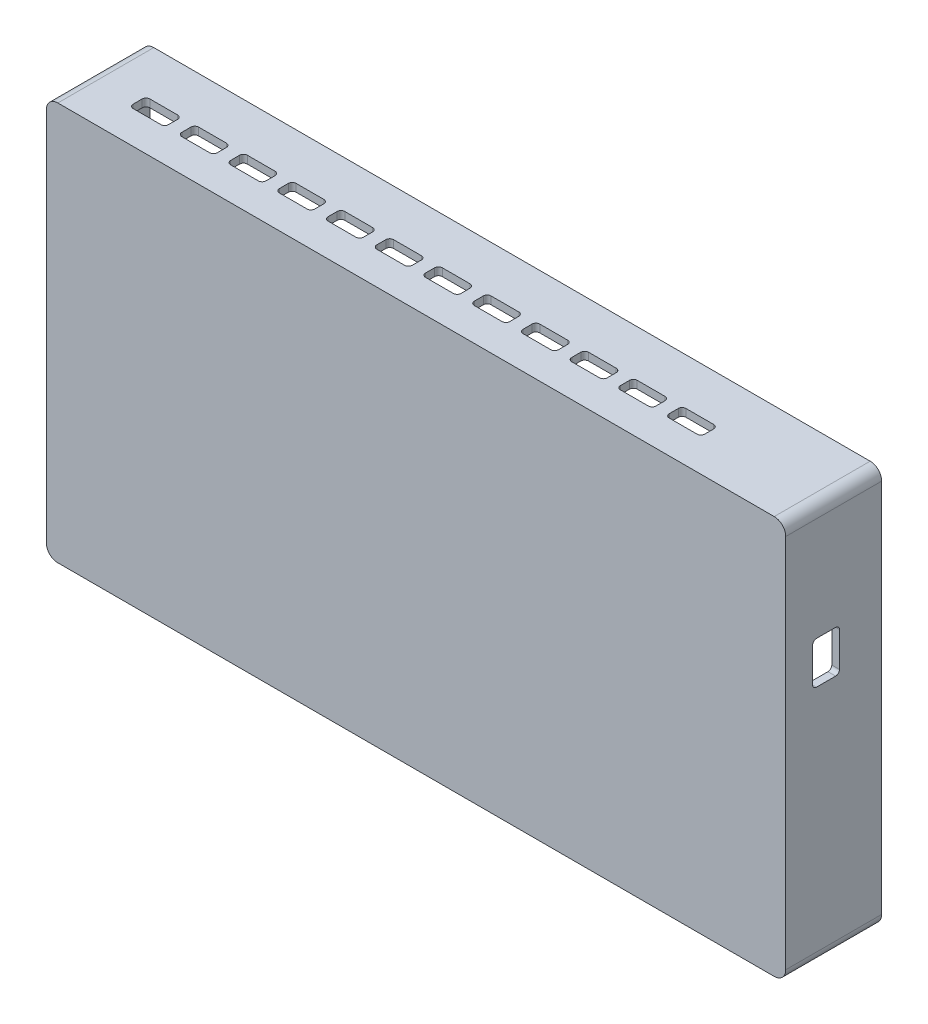
from build123d import *

# Parameters (mm, degrees)
BOSS_EXTRUDE1_START           = 5
BOSS_EXTRUDE1_DEPTH           = 2
SKETCH11_R                    = 3
BOSS_EXTRUDE2_DEPTH           = 3.5
SKETCH12_R                    = 1.05
BOSS_EXTRUDE3_DEPTH           = 1.5
BOSS_EXTRUDE3_DRAFT           = 10
BOSS_EXTRUDE3_PROFILE_2_DEPTH = 1.5
BOSS_EXTRUDE3_PROFILE_2_DRAFT = 10
BOSS_EXTRUDE3_PROFILE_3_DEPTH = 1.5
BOSS_EXTRUDE3_PROFILE_3_DRAFT = 10
BOSS_EXTRUDE3_PROFILE_4_DEPTH = 1.5
BOSS_EXTRUDE3_PROFILE_4_DRAFT = 10
FILLET2_R                     = 2
SKETCH13_R                    = 1.6
CUT_EXTRUDE1_DEPTH            = 3
BOSS_EXTRUDE4_START           = 23
BOSS_EXTRUDE4_DEPTH           = 23
FILLET3_R                     = 1
CUT_EXTRUDE2_DEPTH            = 2
LPATTERN1_COUNT               = 12
LPATTERN1_PITCH               = 12.7
SKETCH17_W                    = 7
SKETCH17_H                    = 11
CUT_EXTRUDE3_DEPTH            = 2
FILLET4_R                     = 1


with BuildPart() as part:
    # Sketch2 → Boss-Extrude1 (new body)
    with BuildSketch(Plane.XY.offset(BOSS_EXTRUDE1_START)):
        with BuildLine():
            Line((-186.174, -3.5), (0.5, -3.5))
            ThreePointArc((0.5, -3.5), (2.621320344, -2.621320344), (3.5, -0.5))
            Line((3.5, -0.5), (3.5, 97.274))
            ThreePointArc((3.5, 97.274), (2.621320344, 99.395320344), (0.5, 100.274))
            Line((0.5, 100.274), (-186.174, 100.274))
            ThreePointArc((-186.174, 100.274), (-188.295320344, 99.395320344), (-189.174, 97.274))
            Line((-189.174, 97.274), (-189.174, -0.5))
            ThreePointArc((-189.174, -0.5), (-188.295320344, -2.621320344), (-186.174, -3.5))
        make_face()
    extrude(amount=BOSS_EXTRUDE1_DEPTH)

    # Sketch11 → Boss-Extrude2 (add)
    with BuildSketch(Plane(origin=(0, 0, 5), x_dir=(-1, 0, 0), z_dir=(0, 0, -1))):
        with Locations((7.366, 91.059)):
            Circle(SKETCH11_R)
        with Locations((7.366, 4.699)):
            Circle(SKETCH11_R)
        with Locations((104.648, 42.799)):
            Circle(SKETCH11_R)
        with Locations((179.324, 5.207)):
            Circle(SKETCH11_R)
        with Locations((179.578, 75.565)):
            Circle(SKETCH11_R)
    extrude(amount=BOSS_EXTRUDE2_DEPTH)


with BuildPart() as boss_extrude3_tool:
    # Sketch12 → Boss-Extrude3 (with draft: the straight prism first)
    with BuildSketch(Plane(origin=(0, 0, 1.5), x_dir=(-1, 0, 0), z_dir=(0, 0, -1))):
        with Locations((7.366, 91.059)):
            Circle(SKETCH12_R)
    extrude(amount=BOSS_EXTRUDE3_DEPTH)
    # Boss-Extrude3: the draft: its side faces are tilted about the plane it starts from
    boss_extrude3_sides = [boss_extrude3_tool.faces().sort_by_distance(p)[0] for p in [
        (-6.316, 91.059, 0.75),
    ]]
    draft(boss_extrude3_sides, Plane(origin=(0, 0, 1.5), x_dir=(-1, 0, 0), z_dir=(0, 0, -1)), BOSS_EXTRUDE3_DRAFT)


with BuildPart() as part_1:
    add(part.part)

    # Boss-Extrude3: add boss_extrude3_tool
    add(boss_extrude3_tool.part)


with BuildPart() as boss_extrude3_profile_2_tool:
    # Sketch12 → Boss-Extrude3 profile 2 (with draft: the straight prism first)
    with BuildSketch(Plane(origin=(0, 0, 1.5), x_dir=(-1, 0, 0), z_dir=(0, 0, -1))):
        with Locations((7.366, 4.699)):
            Circle(SKETCH12_R)
    extrude(amount=BOSS_EXTRUDE3_PROFILE_2_DEPTH)
    # Boss-Extrude3 profile 2: the draft: its side faces are tilted about the plane it starts from
    boss_extrude3_profile_2_sides = [boss_extrude3_profile_2_tool.faces().sort_by_distance(p)[0] for p in [
        (-6.316, 4.699, 0.75),
    ]]
    draft(boss_extrude3_profile_2_sides, Plane(origin=(0, 0, 1.5), x_dir=(-1, 0, 0), z_dir=(0, 0, -1)), BOSS_EXTRUDE3_PROFILE_2_DRAFT)


with BuildPart() as part_2:
    add(part_1.part)

    # Boss-Extrude3 profile 2: add boss_extrude3_profile_2_tool
    add(boss_extrude3_profile_2_tool.part)


with BuildPart() as boss_extrude3_profile_3_tool:
    # Sketch12 → Boss-Extrude3 profile 3 (with draft: the straight prism first)
    with BuildSketch(Plane(origin=(0, 0, 1.5), x_dir=(-1, 0, 0), z_dir=(0, 0, -1))):
        with Locations((179.578, 75.565)):
            Circle(SKETCH12_R)
    extrude(amount=BOSS_EXTRUDE3_PROFILE_3_DEPTH)
    # Boss-Extrude3 profile 3: the draft: its side faces are tilted about the plane it starts from
    boss_extrude3_profile_3_sides = [boss_extrude3_profile_3_tool.faces().sort_by_distance(p)[0] for p in [
        (-178.528, 75.565, 0.75),
    ]]
    draft(boss_extrude3_profile_3_sides, Plane(origin=(0, 0, 1.5), x_dir=(-1, 0, 0), z_dir=(0, 0, -1)), BOSS_EXTRUDE3_PROFILE_3_DRAFT)


with BuildPart() as part_3:
    add(part_2.part)

    # Boss-Extrude3 profile 3: add boss_extrude3_profile_3_tool
    add(boss_extrude3_profile_3_tool.part)


with BuildPart() as boss_extrude3_profile_4_tool:
    # Sketch12 → Boss-Extrude3 profile 4 (with draft: the straight prism first)
    with BuildSketch(Plane(origin=(0, 0, 1.5), x_dir=(-1, 0, 0), z_dir=(0, 0, -1))):
        with Locations((179.324, 5.207)):
            Circle(SKETCH12_R)
    extrude(amount=BOSS_EXTRUDE3_PROFILE_4_DEPTH)
    # Boss-Extrude3 profile 4: the draft: its side faces are tilted about the plane it starts from
    boss_extrude3_profile_4_sides = [boss_extrude3_profile_4_tool.faces().sort_by_distance(p)[0] for p in [
        (-178.274, 5.207, 0.75),
    ]]
    draft(boss_extrude3_profile_4_sides, Plane(origin=(0, 0, 1.5), x_dir=(-1, 0, 0), z_dir=(0, 0, -1)), BOSS_EXTRUDE3_PROFILE_4_DRAFT)


with BuildPart() as part_4:
    add(part_3.part)

    # Boss-Extrude3 profile 4: add boss_extrude3_profile_4_tool
    add(boss_extrude3_profile_4_tool.part)

    # Fillet2
    fillet2_edges = [part_4.edges().sort_by_distance(p)[0] for p in [
        (-4.366, 91.059, 5),
        (-4.366, 4.699, 5),
        (-101.648, 42.799, 5),
        (-176.324, 5.207, 5),
        (-176.578, 75.565, 5),
    ]]
    fillet(fillet2_edges, radius=FILLET2_R)

    # Sketch13 → Cut-Extrude1 (cut)
    with BuildSketch(Plane(origin=(0, 0, 1.5), x_dir=(-1, 0, 0), z_dir=(0, 0, -1))):
        with Locations((104.648, 42.799)):
            Circle(SKETCH13_R)
    extrude(amount=-CUT_EXTRUDE1_DEPTH, mode=Mode.SUBTRACT)

    # Sketch15 → Boss-Extrude4 (add)
    with BuildSketch(Plane(origin=(0, 0, 5), x_dir=(-1, 0, 0), z_dir=(0, 0, -1)).offset(BOSS_EXTRUDE4_START)):
        with BuildLine():
            Line((189.174, -0.5), (189.174, 97.274))
            ThreePointArc((189.174, 97.274), (188.295320344, 99.395320344), (186.174, 100.274))
            Line((186.174, 100.274), (-0.5, 100.274))
            ThreePointArc((-0.5, 100.274), (-2.621320344, 99.395320344), (-3.5, 97.274))
            Line((-3.5, 97.274), (-3.5, -0.5))
            ThreePointArc((-3.5, -0.5), (-2.621320344, -2.621320344), (-0.5, -3.5))
            Line((-0.5, -3.5), (186.174, -3.5))
            ThreePointArc((186.174, -3.5), (188.295320344, -2.621320344), (189.174, -0.5))
        make_face()
        with BuildLine():
            Line((187.174, -0.5), (187.174, 97.274))
            ThreePointArc((187.174, 97.274), (186.881106781, 97.981106781), (186.174, 98.274))
            Line((186.174, 98.274), (-0.5, 98.274))
            ThreePointArc((-0.5, 98.274), (-1.207106781, 97.981106781), (-1.5, 97.274))
            Line((-1.5, 97.274), (-1.5, -0.5))
            ThreePointArc((-1.5, -0.5), (-1.207106781, -1.207106781), (-0.5, -1.5))
            Line((-0.5, -1.5), (186.174, -1.5))
            ThreePointArc((186.174, -1.5), (186.881106781, -1.207106781), (187.174, -0.5))
        make_face(mode=Mode.SUBTRACT)
    extrude(amount=-BOSS_EXTRUDE4_DEPTH)

    # Fillet3
    fillet3_edges = [part_4.edges().sort_by_distance(p)[0] for p in [
        (-186.881106781, -1.207106781, 5),
        (-187.174, 48.387, 5),
        (-186.881106781, 97.981106781, 5),
        (-92.837, 98.274, 5),
        (1.207106781, 97.981106781, 5),
        (1.5, 48.387, 5),
        (1.207106781, -1.207106781, 5),
        (-92.837, -1.5, 5),
    ]]
    fillet(fillet3_edges, radius=FILLET3_R)

    # Sketch16 → Cut-Extrude2 (cut)
    with BuildSketch(Plane(origin=(0, 100.274, 0), x_dir=(1, 0, 0), z_dir=(0, 1, 0))):
        with BuildLine():
            Line((-35.39506459, 1.546056445), (-28.16629252, 1.546056445))
            ThreePointArc((-28.16629252, 1.546056445), (-27.459185739, 1.838949664), (-27.16629252, 2.546056445))
            Line((-27.16629252, 2.546056445), (-27.16629252, 4.899185625))
            ThreePointArc((-27.16629252, 4.899185625), (-27.459185739, 5.606292407), (-28.16629252, 5.899185625))
            Line((-28.16629252, 5.899185625), (-35.39506459, 5.899185625))
            ThreePointArc((-35.39506459, 5.899185625), (-36.102171371, 5.606292407), (-36.39506459, 4.899185625))
            Line((-36.39506459, 4.899185625), (-36.39506459, 2.546056445))
            ThreePointArc((-36.39506459, 2.546056445), (-36.102171371, 1.838949664), (-35.39506459, 1.546056445))
        make_face()
    cut_extrude2 = extrude(amount=-CUT_EXTRUDE2_DEPTH, mode=Mode.SUBTRACT)

    # LPattern1: Cut-Extrude2 ×12
    with Locations(*[(-i * LPATTERN1_PITCH, 0, 0) for i in range(1, LPATTERN1_COUNT)]):
        add(cut_extrude2, mode=Mode.SUBTRACT)

    # Sketch17 → Cut-Extrude3 (cut)
    with BuildSketch(Plane(origin=(3.5, 0, 0), x_dir=(0, 0, -1), z_dir=(1, 0, 0))):
        with Locations((3.5, 64.774)):
            Rectangle(SKETCH17_W, SKETCH17_H)
    extrude(amount=-CUT_EXTRUDE3_DEPTH, mode=Mode.SUBTRACT)

    # Fillet4
    fillet4_edges = [part_4.edges().sort_by_distance(p)[0] for p in [
        (2.5, 59.274, 0),
        (2.5, 70.274, 0),
        (2.5, 70.274, -7),
        (2.5, 59.274, -7),
    ]]
    fillet(fillet4_edges, radius=FILLET4_R)


solid = part_4.part
